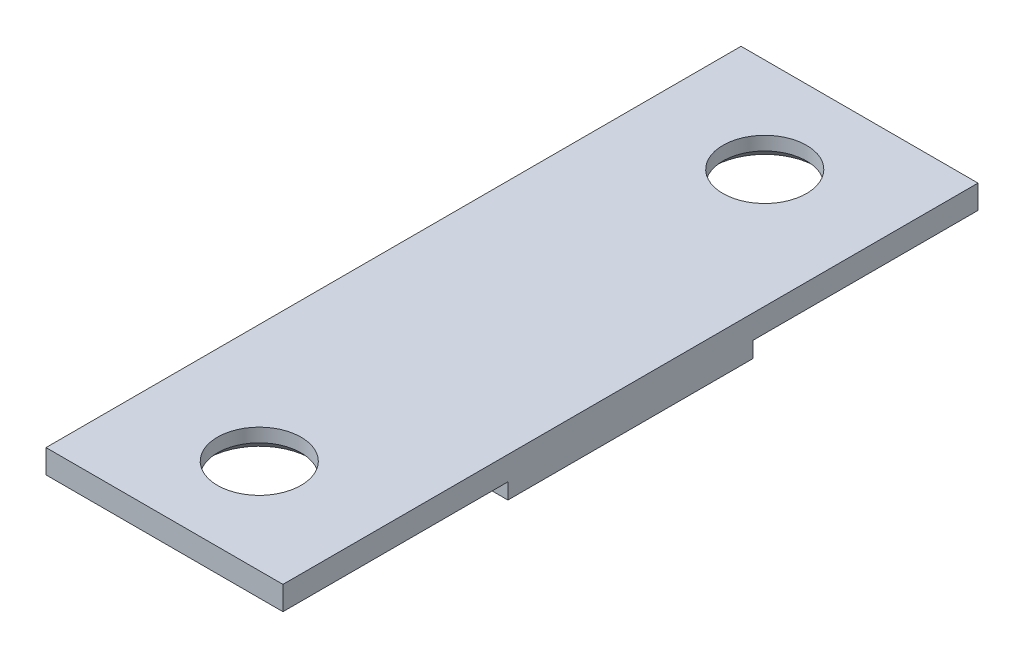
from build123d import *

# Parameters (mm, degrees)
SKETCH1_W      = 11.90625
SKETCH1_H      = 34.925
EXTRUDE1_DEPTH = 1.984375
SKETCH4_W      = 11.90625
SKETCH4_H      = 11.303912273
EXTRUDE3_DEPTH = 0.79375
SKETCH2_R      = 2.1
EXTRUDE2_DEPTH = 1.984375
CHAMFER1_SIZE  = 0.508


with BuildPart() as part:
    # Sketch1 → Extrude1 (new body)
    with BuildSketch(Plane(origin=(0, 0, 0), x_dir=(1, 0, 0), z_dir=(0, 1, 0))):
        Rectangle(SKETCH1_W, SKETCH1_H)
    extrude(amount=EXTRUDE1_DEPTH)

    # Sketch4 → Extrude3 (cut)
    with BuildSketch(Plane.XZ):
        with Locations((0, 11.810543864)):
            Rectangle(SKETCH4_W, SKETCH4_H)
    extrude3 = extrude(amount=-EXTRUDE3_DEPTH, mode=Mode.SUBTRACT)

    # Mirror1: Extrude3 across plane
    add(extrude3.mirror(Plane.XY), mode=Mode.SUBTRACT)

    # Sketch2 → Extrude2 (cut)
    with BuildSketch(Plane(origin=(0, 1.984375, 0), x_dir=(1, 0, 0), z_dir=(0, 1, 0))):
        with Locations(Location((0, 12.7, 0), (0, 0, 270))):
            Circle(SKETCH2_R)
        with Locations(Location((0, -12.7, 0), (0, 0, 270))):
            Circle(SKETCH2_R)
    extrude(amount=-EXTRUDE2_DEPTH, mode=Mode.SUBTRACT)

    # Chamfer1
    chamfer1_edges = [part.edges().sort_by_distance(p)[0] for p in [
        (0, 0.79375, -14.8),
        (0, 0.79375, 10.6),
    ]]
    chamfer(chamfer1_edges, length=CHAMFER1_SIZE)


solid = part.part
